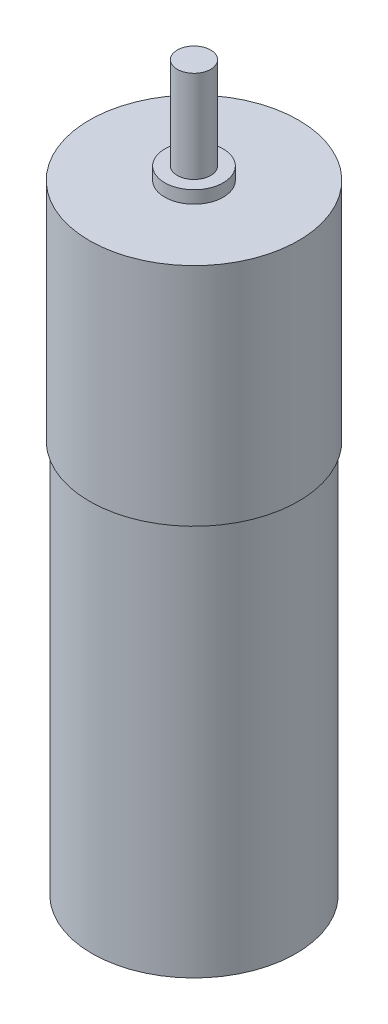
from build123d import *

# Parameters (mm, degrees)
SKETCH1_R           = 12.2
BOSS_EXTRUDE1_DEPTH = 23.5
SKETCH2_R           = 12.5
BOSS_EXTRUDE2_DEPTH = 27
SKETCH3_R           = 3.5
BOSS_EXTRUDE3_DEPTH = 1.5
SKETCH4_R           = 2
BOSS_EXTRUDE4_DEPTH = 11


with BuildPart() as part:
    # Sketch1 → Boss-Extrude1 (new, symmetric)
    with BuildSketch(Plane(origin=(0, 0, 0), x_dir=(1, 0, 0), z_dir=(0, 1, 0))):
        with Locations(Location((0, 0, 0), (0, 0, 270))):
            Circle(SKETCH1_R)
    extrude(amount=BOSS_EXTRUDE1_DEPTH, both=True)

    # Sketch2 → Boss-Extrude2 (add)
    with BuildSketch(Plane(origin=(0, 23.5, 0), x_dir=(1, 0, 0), z_dir=(0, 1, 0))):
        with Locations(Location((0, 0, 0), (0, 0, 270))):
            Circle(SKETCH2_R)
    extrude(amount=BOSS_EXTRUDE2_DEPTH)

    # Sketch3 → Boss-Extrude3 (add)
    with BuildSketch(Plane(origin=(0, 50.5, 0), x_dir=(1, 0, 0), z_dir=(0, 1, 0))):
        with Locations(Location((0, 0, 0), (0, 0, 270))):
            Circle(SKETCH3_R)
    extrude(amount=BOSS_EXTRUDE3_DEPTH)

    # Sketch4 → Boss-Extrude4 (add)
    with BuildSketch(Plane(origin=(0, 52, 0), x_dir=(1, 0, 0), z_dir=(0, 1, 0))):
        with Locations(Location((0, 0, 0), (0, 0, 270))):
            Circle(SKETCH4_R)
    extrude(amount=BOSS_EXTRUDE4_DEPTH)


solid = part.part
